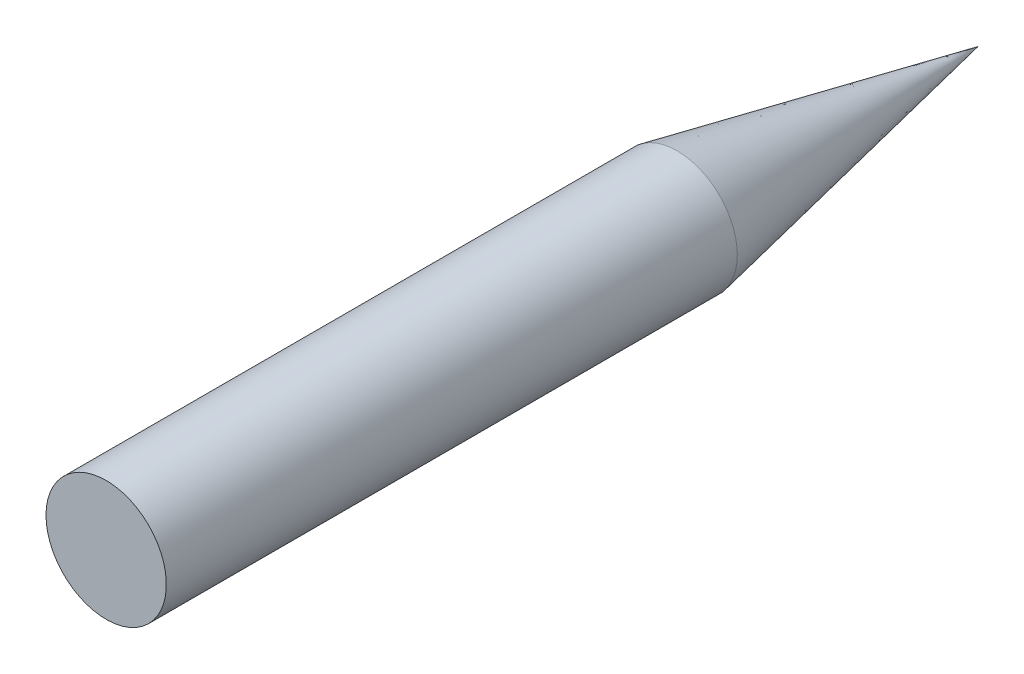
from build123d import *


with BuildPart() as part:
    # Sketch1 → Revolve1 (revolve)
    with BuildSketch(Plane.XZ, mode=Mode.PRIVATE) as revolve1_sk:
        Polygon((3.175, 1), (0, 1), (0, -45), (3.175, -29.125), align=None)
    revolve(revolve1_sk.sketch.rotate(Axis((0, 0, 1), (0, 0, -1)), 180), axis=Axis((0, 0, 1), (0, 0, -1)))


solid = part.part
